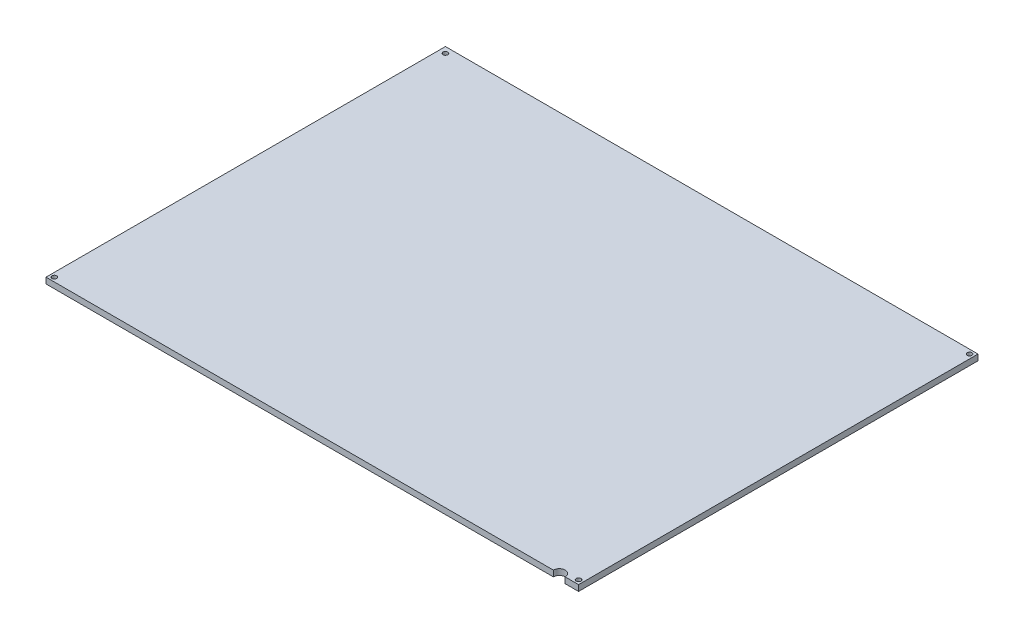
from build123d import *

# Parameters (mm, degrees)
SKETCH1_W           = 900
SKETCH1_H           = 675
BOSS_EXTRUDE1_DEPTH = 10
SKETCH3_R           = 4
CUT_EXTRUDE1_DEPTH  = 10
SKETCH4_R           = 4
CUT_EXTRUDE2_DEPTH  = 10
SKETCH5_R           = 4
CUT_EXTRUDE3_DEPTH  = 10
SKETCH6_R           = 4
CUT_EXTRUDE4_DEPTH  = 10
SKETCH7_R           = 10
CUT_EXTRUDE5_DEPTH  = 10


with BuildPart() as part:
    # Sketch1 → Boss-Extrude1 (new body)
    with BuildSketch(Plane(origin=(0, 0, 0), x_dir=(1, 0, 0), z_dir=(0, 1, 0))):
        Rectangle(SKETCH1_W, SKETCH1_H)
    extrude(amount=BOSS_EXTRUDE1_DEPTH)

    # Sketch3 → Cut-Extrude1 (cut)
    with BuildSketch(Plane(origin=(0, 10, 0), x_dir=(1, 0, 0), z_dir=(0, 1, 0))):
        with Locations(Location((-440, 327.5, 0), (0, 0, 270))):
            Circle(SKETCH3_R)
    extrude(amount=-CUT_EXTRUDE1_DEPTH, mode=Mode.SUBTRACT)

    # Sketch4 → Cut-Extrude2 (cut)
    with BuildSketch(Plane(origin=(0, 10, 0), x_dir=(1, 0, 0), z_dir=(0, 1, 0))):
        with Locations(Location((-442.928932188, -330.428932188, 0), (0, 0, 270))):
            Circle(SKETCH4_R)
    extrude(amount=-CUT_EXTRUDE2_DEPTH, mode=Mode.SUBTRACT)

    # Sketch5 → Cut-Extrude3 (cut)
    with BuildSketch(Plane(origin=(0, 10, 0), x_dir=(1, 0, 0), z_dir=(0, 1, 0))):
        with Locations(Location((442.928932188, 330.428932188, 0), (0, 0, 270))):
            Circle(SKETCH5_R)
    extrude(amount=-CUT_EXTRUDE3_DEPTH, mode=Mode.SUBTRACT)

    # Sketch6 → Cut-Extrude4 (cut)
    with BuildSketch(Plane(origin=(0, 10, 0), x_dir=(1, 0, 0), z_dir=(0, 1, 0))):
        with Locations(Location((442.928932188, -330.428932188, 0), (0, 0, 270))):
            Circle(SKETCH6_R)
    extrude(amount=-CUT_EXTRUDE4_DEPTH, mode=Mode.SUBTRACT)

    # Sketch7 → Cut-Extrude5 (cut)
    with BuildSketch(Plane(origin=(0, 10, 0), x_dir=(1, 0, 0), z_dir=(0, 1, 0))):
        with Locations((417.383273444, -337.5)):
            Circle(SKETCH7_R)
    extrude(amount=-CUT_EXTRUDE5_DEPTH, mode=Mode.SUBTRACT)


solid = part.part
